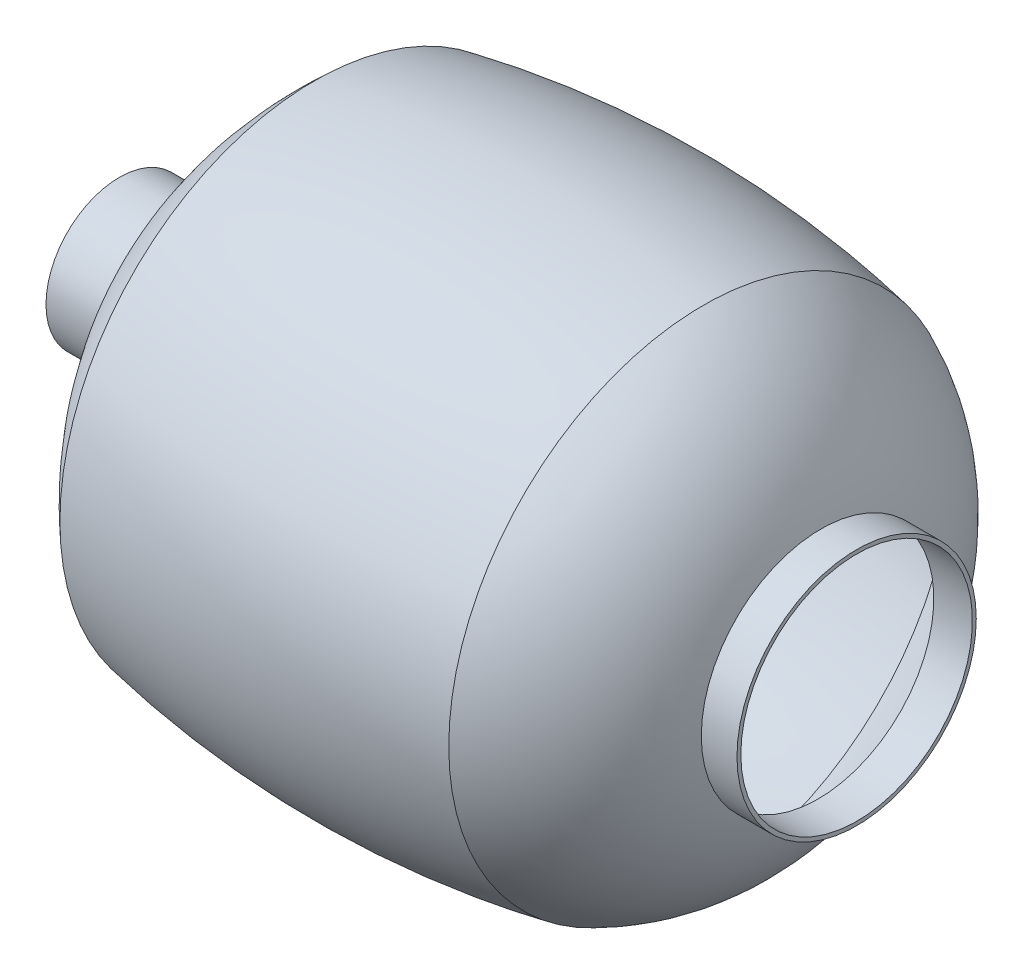
from build123d import *


with BuildPart() as part:
    # Sketch1 → Revolve12 (revolve)
    with BuildSketch(Plane.XY, mode=Mode.PRIVATE) as revolve12_sk:
        with BuildLine():
            Line((90, -30), (90, -31))
            Line((90, -31), (80.7609802, -31))
            ThreePointArc((80.7609802, -31), (69.438288543, -51.885458343), (50.299569576, -65.960796808))
            ThreePointArc((50.299569576, -65.960796808), (-0.0832958, -70.740460189), (-50.463169793, -65.929368635))
            ThreePointArc((-50.463169793, -65.929368635), (-68.715343335, -44.475254652), (-80.7333401, -19))
            Line((-80.7333401, -19), (-101, -19))
            Line((-101, -19), (-101, -18))
            Line((-101, -18), (-80, -18))
            ThreePointArc((-80, -18), (-68.14725974, -43.508889196), (-50, -65))
            ThreePointArc((-50, -65), (0, -69.740473179), (50, -65))
            ThreePointArc((50, -65), (68.967576435, -50.900779801), (80, -30))
            Line((80, -30), (90, -30))
        make_face()
    revolve(revolve12_sk.sketch.rotate(Axis((-101, 0, 0), (1, 0, 0)), 270), axis=Axis((-101, 0, 0), (1, 0, 0)))


solid = part.part
